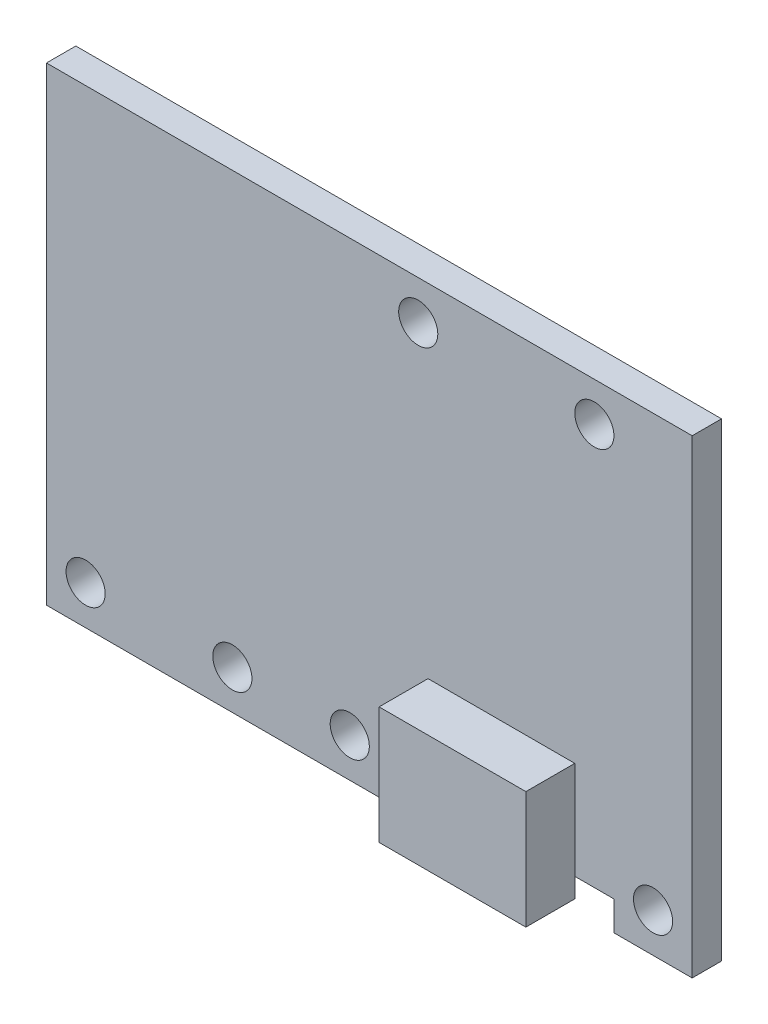
from build123d import *

# Parameters (mm, degrees)
SKETCH_1_R      = 1
EXTRUDE_1_DEPTH = 1.5
SKETCH_2_W      = 7.5
SKETCH_2_H      = 6
EXTRUDE_2_DEPTH = 2.5


with BuildPart() as part:
    # Эскиз1 → Бобышка-Вытянуть1 (new body)
    with BuildSketch(Plane.XY):
        Polygon((16.5, 12), (-16.5, 12), (-16.5, -12), (1, -12), (1, -10.5), (12.5, -10.5), (12.5, -12), (16.5, -12), align=None)
        with Locations((-14.5, -10)):
            Circle(SKETCH_1_R, mode=Mode.SUBTRACT)
        with Locations((-7, -10)):
            Circle(SKETCH_1_R, mode=Mode.SUBTRACT)
        with Locations((-1, -10)):
            Circle(SKETCH_1_R, mode=Mode.SUBTRACT)
        with Locations((14.5, -10)):
            Circle(SKETCH_1_R, mode=Mode.SUBTRACT)
        with Locations((2.5, 10)):
            Circle(SKETCH_1_R, mode=Mode.SUBTRACT)
        with Locations((11.5, 10)):
            Circle(SKETCH_1_R, mode=Mode.SUBTRACT)
    extrude(amount=-EXTRUDE_1_DEPTH)

    # Эскиз2 → Бобышка-Вытянуть2 (add)
    with BuildSketch(Plane.XY):
        with Locations((6.75, -8.5)):
            Rectangle(SKETCH_2_W, SKETCH_2_H)
    extrude(amount=EXTRUDE_2_DEPTH)


solid = part.part
